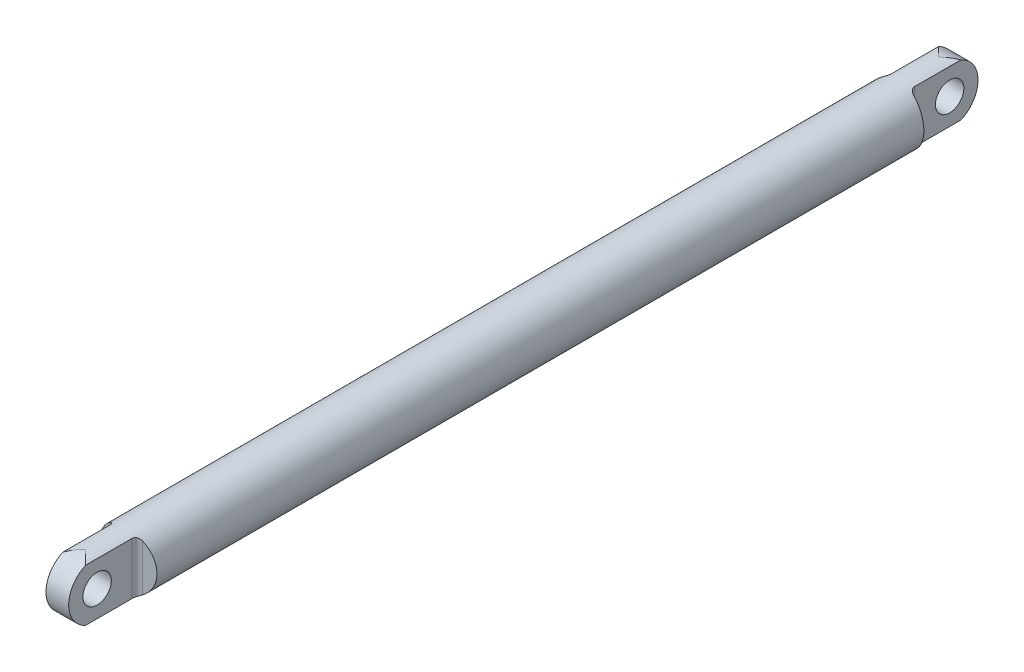
from build123d import *

# Parameters (mm, degrees)
SKETCH1_R            = 5
BOSS_EXTRUDE1_DEPTH  = 80
CUT_EXTRUDE2_DEPTH   = 81.311892021
CUT_EXTRUDE3_DEPTH   = 81.311892021
SKETCH8_R            = 2.5
CUT_EXTRUDE4_DEPTH   = 81.46117076
FILLET1_R            = 1
FILLET1_OF_MIRROR2_R = 1


with BuildPart() as part:
    # Sketch1 → Boss-Extrude1 (new, symmetric)
    with BuildSketch(Plane.XY):
        Circle(SKETCH1_R)
    extrude(amount=BOSS_EXTRUDE1_DEPTH, both=True)

    # Sketch6 → Cut-Extrude2 (cut, symmetric)
    with BuildSketch(Plane(origin=(0, 0, 0), x_dir=(0, 0, -1), z_dir=(1, 0, 0))):
        with BuildLine():
            Line((80, 0), (80, 5))
            Line((80, 5), (75, 5))
            ThreePointArc((75, 5), (78.535533906, 3.535533906), (80, 0))
        make_face()
        with BuildLine():
            Line((80, -5), (80, 0))
            ThreePointArc((80, 0), (78.535533906, -3.535533906), (75, -5))
            Line((75, -5), (80, -5))
        make_face()
    cut_extrude2 = extrude(amount=CUT_EXTRUDE2_DEPTH, both=True, mode=Mode.SUBTRACT)

    # Sketch7 → Cut-Extrude3 (cut, symmetric)
    with BuildSketch(Plane(origin=(0, 0, 0), x_dir=(1, 0, 0), z_dir=(0, 1, 0))):
        Polygon((-2, 80), (-2, 68), (-5, 67.471019058), (-5, 80), align=None)
        Polygon((5, 80), (2, 80), (2, 68), (5, 67.471019058), align=None)
    cut_extrude3 = extrude(amount=CUT_EXTRUDE3_DEPTH, both=True, mode=Mode.SUBTRACT)

    # Sketch8 → Cut-Extrude4 (cut, symmetric)
    with BuildSketch(Plane(origin=(-2, 0, 0), x_dir=(0, 0, -1), z_dir=(1, 0, 0))):
        with Locations((75, 0)):
            Circle(SKETCH8_R)
    cut_extrude4 = extrude(amount=CUT_EXTRUDE4_DEPTH, both=True, mode=Mode.SUBTRACT)

    # Fillet1
    fillet1_edges = [part.edges().sort_by_distance(p)[0] for p in [
        (-2, 0, -68),
        (2, 0, -68),
    ]]
    fillet(fillet1_edges, radius=FILLET1_R)

    # Mirror2: Cut-Extrude2, Cut-Extrude3, Cut-Extrude4 across plane
    add(cut_extrude2.mirror(Plane.XY), mode=Mode.SUBTRACT)
    add(cut_extrude3.mirror(Plane.XY), mode=Mode.SUBTRACT)
    add(cut_extrude4.mirror(Plane.XY), mode=Mode.SUBTRACT)

    # Fillet1 of Mirror2
    fillet1_of_mirror2_edges = [part.edges().sort_by_distance(p)[0] for p in [
        (-2, 0, 68),
        (2, 0, 68),
    ]]
    fillet(fillet1_of_mirror2_edges, radius=FILLET1_OF_MIRROR2_R)


solid = part.part
